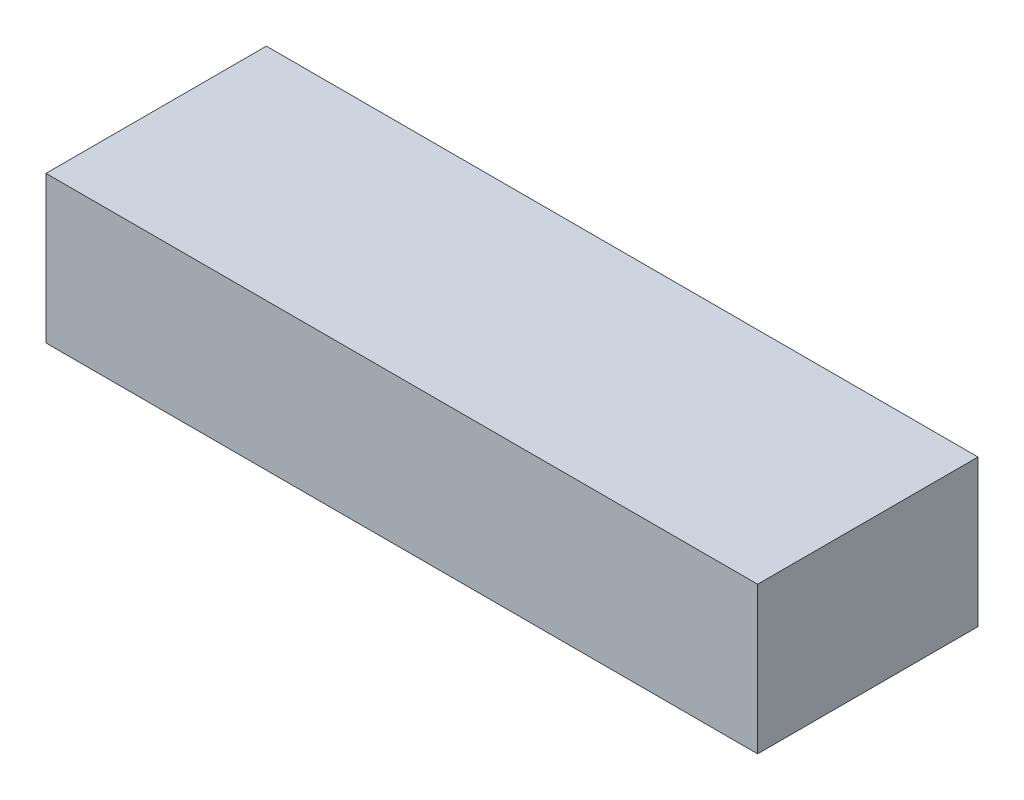
from build123d import *

# Parameters (mm, degrees)
SKETCH1_W           = 155
SKETCH1_H           = 48
BOSS_EXTRUDE1_DEPTH = 16


with BuildPart() as part:
    # Sketch1 → Boss-Extrude1 (new, symmetric)
    with BuildSketch(Plane(origin=(0, 0, 0), x_dir=(1, 0, 0), z_dir=(0, 1, 0))):
        Rectangle(SKETCH1_W, SKETCH1_H)
    extrude(amount=BOSS_EXTRUDE1_DEPTH, both=True)


solid = part.part
